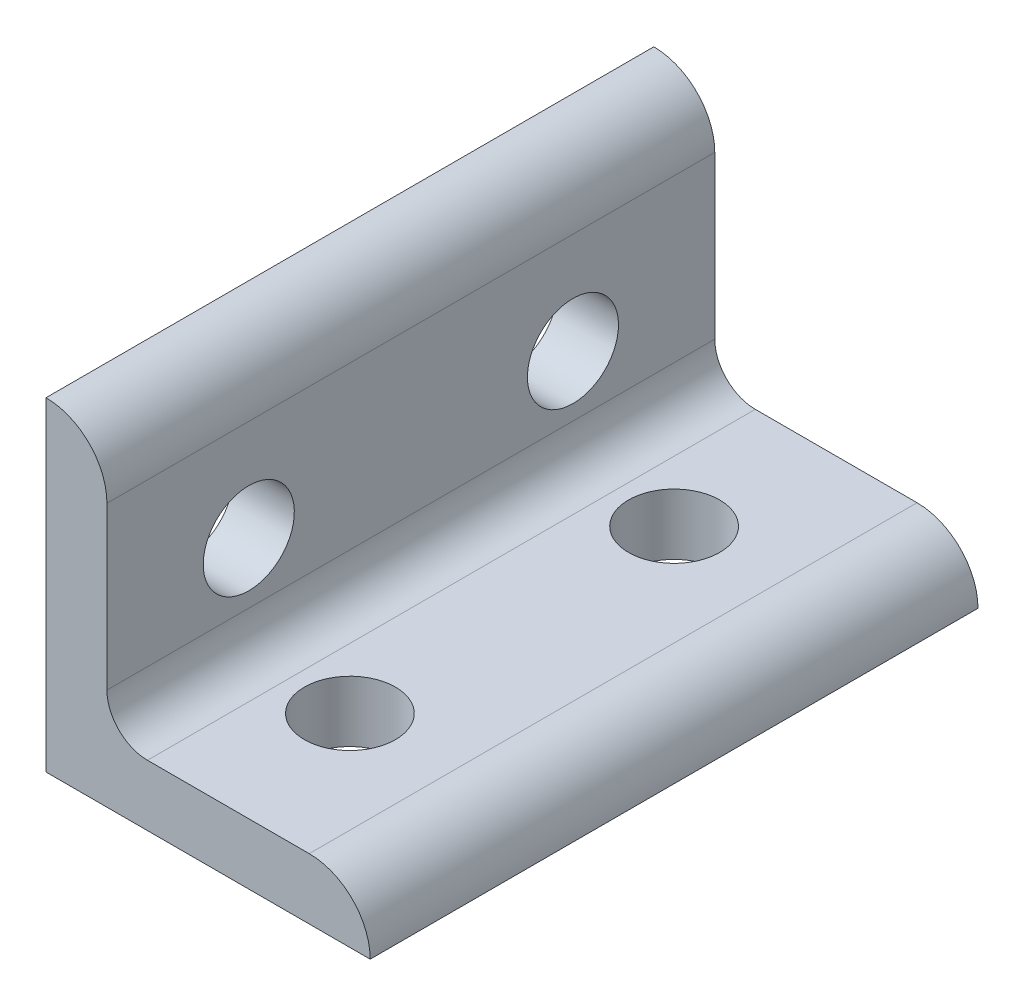
from build123d import *

# Parameters (mm, degrees)
BOSS_EXTRUDE1_DEPTH = 23.8125
SKETCH2_R           = 3.5687
CUT_EXTRUDE1_DEPTH  = 44.097043475
SKETCH3_R           = 3.5687
CUT_EXTRUDE2_DEPTH  = 44.097043475


with BuildPart() as part:
    # Sketch1 → Boss-Extrude1 (new, symmetric)
    with BuildSketch(Plane.XY):
        with BuildLine():
            Line((0, 0), (0, 25.4))
            ThreePointArc((0, 25.4), (3.376576302, 24.001376302), (4.7752, 20.6248))
            Line((4.7752, 20.6248), (4.7752, 7.9502))
            ThreePointArc((4.7752, 7.9502), (5.70513597, 5.70513597), (7.9502, 4.7752))
            Line((7.9502, 4.7752), (20.6248, 4.7752))
            ThreePointArc((20.6248, 4.7752), (24.001376302, 3.376576302), (25.4, 0))
            Line((25.4, 0), (0, 0))
        make_face()
    extrude(amount=BOSS_EXTRUDE1_DEPTH, both=True)

    # Sketch2 → Cut-Extrude1 (cut, through all)
    with BuildSketch(Plane(origin=(0, 0, 0), x_dir=(1, 0, 0), z_dir=(0, 1, 0))):
        with Locations(Location((12.7, -12.7, 0), (0, 0, 90))):
            Circle(SKETCH2_R)
        with Locations(Location((12.7, 12.7, 0), (0, 0, 90))):
            Circle(SKETCH2_R)
    extrude(amount=CUT_EXTRUDE1_DEPTH, mode=Mode.SUBTRACT)

    # Sketch3 → Cut-Extrude2 (cut, through all)
    with BuildSketch(Plane(origin=(0, 0, 0), x_dir=(0, 0, -1), z_dir=(1, 0, 0))):
        with Locations(Location((-12.7, 12.7, 0), (0, 0, 270))):
            Circle(SKETCH3_R)
        with Locations(Location((12.7, 12.7, 0), (0, 0, 270))):
            Circle(SKETCH3_R)
    extrude(amount=CUT_EXTRUDE2_DEPTH, mode=Mode.SUBTRACT)


solid = part.part
